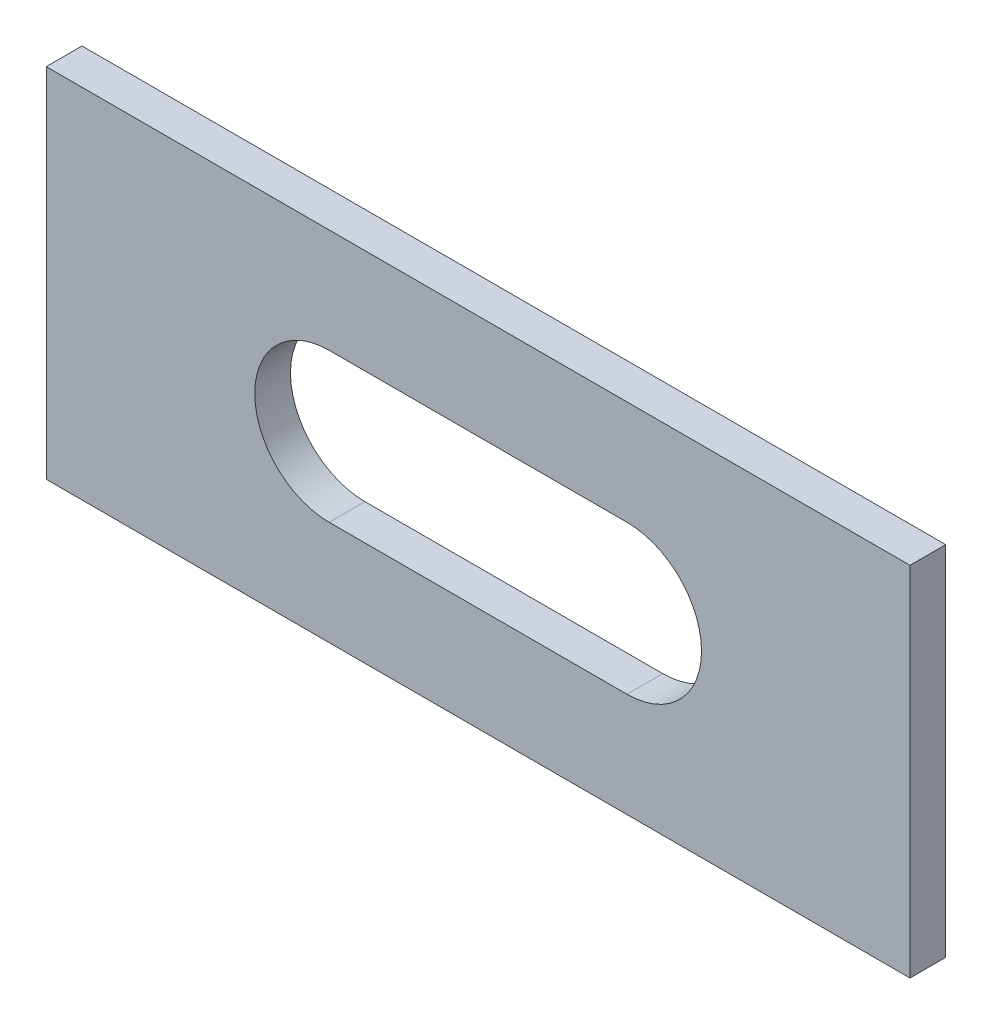
from build123d import *

# Parameters (mm, degrees)
ESBO_O1_W                = 145
ESBO_O1_H                = 60
RESSALTO_EXTRUS_O1_DEPTH = 6


with BuildPart() as part:
    # Esboço1 → Ressalto-extrusão1 (new body)
    with BuildSketch(Plane.XY):
        Rectangle(ESBO_O1_W, ESBO_O1_H)
        with BuildLine():
            Line((-25, 12.5), (25, 12.5))
            ThreePointArc((25, 12.5), (37.5, 0), (25, -12.5))
            Line((25, -12.5), (-25, -12.5))
            ThreePointArc((-25, -12.5), (-37.5, 0), (-25, 12.5))
        make_face(mode=Mode.SUBTRACT)
    extrude(amount=RESSALTO_EXTRUS_O1_DEPTH)


solid = part.part
